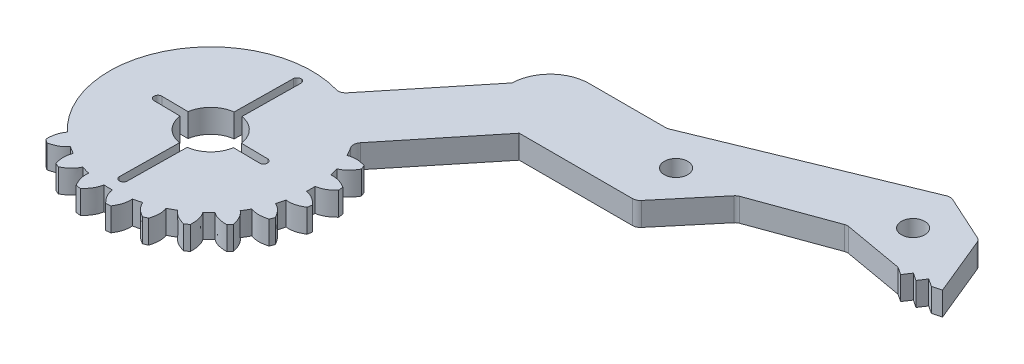
from build123d import *

# Parameters (mm, degrees)
SKETCH1_R           = 1.5
BOSS_EXTRUDE1_DEPTH = 3
BOSS_EXTRUDE2_DEPTH = 3


with BuildPart() as part:
    # Sketch1 → Boss-Extrude1 (new body)
    with BuildSketch(Plane(origin=(0, 0, 0), x_dir=(1, 0, 0), z_dir=(0, 1, 0))):
        with BuildLine():
            Line((0, -5), (15.563704926, -5))
            ThreePointArc((15.563704926, -5), (15.986456688, -4.906245523), (16.329938709, -4.642561896))
            Line((16.329938709, -4.642561896), (21.754639375, 1.826214015))
            ThreePointArc((21.754639375, 1.826214015), (21.947055414, 2.002635145), (22.178576185, 2.123243936))
            Line((22.178576185, 2.123243936), (32.010560432, 5.705074248))
            ThreePointArc((32.010560432, 5.705074248), (32.265408175, 5.761651409), (32.526215439, 5.7503413))
            Line((32.526215439, 5.7503413), (40.193902186, 4.400650355))
            Line((40.193902186, 4.400650355), (41.177822493, 3.749266574))
            Line((41.177822493, 3.749266574), (41.829206274, 4.73318688))
            Line((41.829206274, 4.73318688), (42.81312658, 4.081803099))
            Line((42.81312658, 4.081803099), (43.464510361, 5.065723406))
            Line((43.464510361, 5.065723406), (44.448430668, 4.414339625))
            Line((44.448430668, 4.414339625), (45.592594685, 4.702937447))
            Line((45.592594685, 4.702937447), (42.491745918, 12.244834503))
            ThreePointArc((42.491745918, 12.244834503), (42.287055639, 12.558350103), (41.981402108, 12.774604725))
            Line((41.981402108, 12.774604725), (36.174183924, 15.419882568))
            ThreePointArc((36.174183924, 15.419882568), (35.778323444, 15.509674561), (35.379386093, 15.434727162))
            Line((35.379386093, 15.434727162), (10.182711481, 5.075121772))
            ThreePointArc((10.182711481, 5.075121772), (9.996254378, 5.018960187), (9.802448068, 5))
            Line((9.802448068, 5), (0, 5))
            ThreePointArc((0, 5), (-5, 0), (0, -5))
        make_face()
        with Locations((14.953169387, 1.184367042)):
            Circle(SKETCH1_R, mode=Mode.SUBTRACT)
        with Locations((36.81484199, 9.711510151)):
            Circle(SKETCH1_R, mode=Mode.SUBTRACT)
    extrude(amount=BOSS_EXTRUDE1_DEPTH)

    # Sketch2 → Boss-Extrude2 (add)
    with BuildSketch(Plane(origin=(0, 3, 0), x_dir=(1, 0, 0), z_dir=(0, 1, 0))):
        with BuildLine():
            ThreePointArc((3.389805898, -2.10337971), (3.440094642, -2.035794351), (3.48451646, -1.964216138))
            ThreePointArc((3.48451646, -1.964216138), (2.030149694, 3.446518855), (-3.407273814, 2.095348456))
            ThreePointArc((-3.407273814, 2.095348456), (-3.443238029, 2.040927963), (-3.482673716, 1.988967964))
            Line((-3.482673716, 1.988967964), (-14.477723162, -11.556766533))
            ThreePointArc((-14.477723162, -11.556766533), (-14.954621591, -11.88063891), (-15.531058173, -11.887442925))
            ThreePointArc((-15.531058173, -11.887442925), (-30.143162251, -17.47025394), (-28.811611281, -33.055770821))
            ThreePointArc((-28.811611281, -33.055770821), (-28.435906156, -33.457620181), (-28.043430296, -33.843106819))
            add(Edge.make_bspline(
                [(-28.043430296, -33.843106819), (-28.555703587, -34.513757614), (-28.644931052, -35.244635595), (-28.64994617, -35.971697613)],
                knots=[0, 0, 0, 0, 0.585569533, 0.585569533, 0.585569533, 0.585569533], degree=3))
            ThreePointArc((-28.64994617, -35.971697613), (-28.408345056, -36.165936902), (-28.162781472, -36.355141887))
            add(Edge.make_bspline(
                [(-28.162781472, -36.355141887), (-27.457247623, -36.179453762), (-26.767789168, -35.921013823), (-26.236261071, -35.265518364)],
                knots=[0, 0, 0, 0, 0.585569533, 0.585569533, 0.585569533, 0.585569533], degree=3))
            ThreePointArc((-26.236261071, -35.265518364), (-25.769237301, -35.556483877), (-25.290271355, -35.827341321))
            add(Edge.make_bspline(
                [(-25.290271355, -35.827341321), (-25.611512158, -36.607726329), (-25.50853413, -37.336794014), (-25.325200865, -38.040380002)],
                knots=[0, 0, 0, 0, 0.585569533, 0.585569533, 0.585569533, 0.585569533], degree=3))
            ThreePointArc((-25.325200865, -38.040380002), (-25.041559282, -38.165469778), (-24.755393221, -38.284671227))
            add(Edge.make_bspline(
                [(-24.755393221, -38.284671227), (-24.119371288, -37.932363933), (-23.520294738, -37.504285143), (-23.176532731, -36.733555556)],
                knots=[0, 0, 0, 0, 0.585569533, 0.585569533, 0.585569533, 0.585569533], degree=3))
            ThreePointArc((-23.176532731, -36.733555556), (-22.650115136, -36.893732522), (-22.117366351, -37.031394704))
            add(Edge.make_bspline(
                [(-22.117366351, -37.031394704), (-22.225682637, -37.868331976), (-21.937516898, -38.545904607), (-21.578329109, -39.178066343)],
                knots=[0, 0, 0, 0, 0.585569533, 0.585569533, 0.585569533, 0.585569533], degree=3))
            ThreePointArc((-21.578329109, -39.178066343), (-21.271976762, -39.225481945), (-20.964709967, -39.266556476))
            add(Edge.make_bspline(
                [(-20.964709967, -39.266556476), (-20.441543794, -38.761639173), (-19.973675226, -38.193094393), (-19.841106121, -37.359654625)],
                knots=[0, 0, 0, 0, 0.585569533, 0.585569533, 0.585569533, 0.585569533], degree=3))
            ThreePointArc((-19.841106121, -37.359654625), (-19.291168925, -37.378127071), (-18.740943516, -37.37321272))
            add(Edge.make_bspline(
                [(-18.740943516, -37.37321272), (-18.628953709, -38.209666363), (-18.175238278, -38.789568486), (-17.664674019, -39.307225192)],
                knots=[0, 0, 0, 0, 0.585569533, 0.585569533, 0.585569533, 0.585569533], degree=3))
            ThreePointArc((-17.664674019, -39.307225192), (-17.356488314, -39.273735324), (-17.049060511, -39.233883777))
            add(Edge.make_bspline(
                [(-17.049060511, -39.233883777), (-16.674403007, -38.610765744), (-16.369626891, -37.940500362), (-16.457285053, -37.101147956)],
                knots=[0, 0, 0, 0, 0.585569533, 0.585569533, 0.585569533, 0.585569533], degree=3))
            ThreePointArc((-16.457285053, -37.101147956), (-15.921305484, -36.97665678), (-15.391100488, -36.829501036))
            add(Edge.make_bspline(
                [(-15.391100488, -36.829501036), (-15.066436507, -37.608468117), (-14.478091341, -38.051180359), (-13.850944723, -38.419054587)],
                knots=[0, 0, 0, 0, 0.585569533, 0.585569533, 0.585569533, 0.585569533], degree=3))
            ThreePointArc((-13.850944723, -38.419054587), (-13.561928007, -38.306941529), (-13.275289891, -38.18887972))
            add(Edge.make_bspline(
                [(-13.275289891, -38.18887972), (-13.074673346, -37.490025422), (-12.953759671, -36.763716915), (-13.255671342, -35.975652351)],
                knots=[0, 0, 0, 0, 0.585569533, 0.585569533, 0.585569533, 0.585569533], degree=3))
            ThreePointArc((-13.255671342, -35.975652351), (-12.77017552, -35.716681391), (-12.296123531, -35.437312703))
            add(Edge.make_bspline(
                [(-12.296123531, -35.437312703), (-11.780910691, -36.105707904), (-11.098030541, -36.381060158), (-10.397040569, -36.574081887)],
                knots=[0, 0, 0, 0, 0.585569533, 0.585569533, 0.585569533, 0.585569533], degree=3))
            ThreePointArc((-10.397040569, -36.574081887), (-10.146888853, -36.390985958), (-9.90057434, -36.202759604))
            add(Edge.make_bspline(
                [(-9.90057434, -36.202759604), (-9.88767044, -35.475794806), (-9.958859272, -34.742939899), (-10.45444967, -34.059868475)],
                knots=[0, 0, 0, 0, 0.585569533, 0.585569533, 0.585569533, 0.585569533], degree=3))
            ThreePointArc((-10.45444967, -34.059868475), (-10.052523335, -33.68406617), (-9.666930212, -33.291523058))
            add(Edge.make_bspline(
                [(-9.666930212, -33.291523058), (-8.996279416, -33.803796349), (-8.265401435, -33.893023814), (-7.538339418, -33.898038932)],
                knots=[0, 0, 0, 0, 0.585569533, 0.585569533, 0.585569533, 0.585569533], degree=3))
            ThreePointArc((-7.538339418, -33.898038932), (-7.344100128, -33.656437817), (-7.154895143, -33.410874234))
            add(Edge.make_bspline(
                [(-7.154895143, -33.410874234), (-7.330583268, -32.705340385), (-7.589023207, -32.01588193), (-8.244518666, -31.484353833)],
                knots=[0, 0, 0, 0, 0.585569533, 0.585569533, 0.585569533, 0.585569533], degree=3))
            ThreePointArc((-8.244518666, -31.484353833), (-7.95355245, -31.01733048), (-7.682695709, -30.538364117))
            add(Edge.make_bspline(
                [(-7.682695709, -30.538364117), (-6.902310701, -30.85960492), (-6.173243016, -30.756626892), (-5.469657028, -30.573293627)],
                knots=[0, 0, 0, 0, 0.585569533, 0.585569533, 0.585569533, 0.585569533], degree=3))
            ThreePointArc((-5.469657028, -30.573293627), (-5.344567252, -30.289652043), (-5.225365803, -30.003485982))
            add(Edge.make_bspline(
                [(-5.225365803, -30.003485982), (-5.577673097, -29.36746405), (-6.005751887, -28.768387499), (-6.776481475, -28.424625492)],
                knots=[0, 0, 0, 0, 0.585569533, 0.585569533, 0.585569533, 0.585569533], degree=3))
            ThreePointArc((-6.776481475, -28.424625492), (-6.616304485, -27.898207904), (-6.478642326, -27.365459113))
            add(Edge.make_bspline(
                [(-6.478642326, -27.365459113), (-5.641705054, -27.473775399), (-4.964132423, -27.18560966), (-4.331970687, -26.826421871)],
                knots=[0, 0, 0, 0, 0.585569533, 0.585569533, 0.585569533, 0.585569533], degree=3))
            ThreePointArc((-4.331970687, -26.826421871), (-4.284555085, -26.520069523), (-4.243480554, -26.212802729))
            add(Edge.make_bspline(
                [(-4.243480554, -26.212802729), (-4.748397857, -25.689636555), (-5.316942637, -25.221767987), (-6.150382405, -25.089198883)],
                knots=[0, 0, 0, 0, 0.585569533, 0.585569533, 0.585569533, 0.585569533], degree=3))
            ThreePointArc((-6.150382405, -25.089198883), (-6.131912975, -24.539261649), (-6.13682431, -23.989036278))
            add(Edge.make_bspline(
                [(-6.13682431, -23.989036278), (-5.300370667, -23.877046471), (-4.720468545, -23.42333104), (-4.202811838, -22.912766781)],
                knots=[0, 0, 0, 0, 0.585569533, 0.585569533, 0.585569533, 0.585569533], degree=3))
            ThreePointArc((-4.202811838, -22.912766781), (-4.236301706, -22.604581076), (-4.276153253, -22.297153273))
            add(Edge.make_bspline(
                [(-4.276153253, -22.297153273), (-4.899271286, -21.922495769), (-5.569536668, -21.617719652), (-6.408889074, -21.705377815)],
                knots=[0, 0, 0, 0, 0.585569533, 0.585569533, 0.585569533, 0.585569533], degree=3))
            ThreePointArc((-6.408889074, -21.705377815), (-6.533401359, -21.169403624), (-6.680535995, -20.639193249))
            add(Edge.make_bspline(
                [(-6.680535995, -20.639193249), (-5.901568913, -20.314529269), (-5.458856671, -19.726184103), (-5.090982443, -19.099037485)],
                knots=[0, 0, 0, 0, 0.585569533, 0.585569533, 0.585569533, 0.585569533], degree=3))
            ThreePointArc((-5.090982443, -19.099037485), (-5.203095501, -18.810020768), (-5.32115731, -18.523382653))
            add(Edge.make_bspline(
                [(-5.32115731, -18.523382653), (-6.020011609, -18.322766108), (-6.746320115, -18.201852432), (-7.534384679, -18.503764104)],
                knots=[0, 0, 0, 0, 0.585569533, 0.585569533, 0.585569533, 0.585569533], degree=3))
            ThreePointArc((-7.534384679, -18.503764104), (-7.832131183, -17.949741979), (-8.1563259, -17.410769549))
            ThreePointArc((-8.1563259, -17.410769549), (-8.310437489, -16.816722086), (-8.088540896, -16.244529224))
            Line((-8.088540896, -16.244529224), (3.389805898, -2.10337971))
        make_face()
        with BuildLine():
            ThreePointArc((-18.588322725, -20.921387696), (-16.62578898, -21.934876408), (-15.660972151, -23.921790234))
            Line((-15.660972151, -23.921790234), (-12.269810743, -23.963581954))
            ThreePointArc((-12.269810743, -23.963581954), (-11.776010098, -24.469705382), (-12.282133526, -24.963506026))
            Line((-12.282133526, -24.963506026), (-15.673294934, -24.921714305))
            ThreePointArc((-15.673294934, -24.921714305), (-16.686783646, -26.88424805), (-18.673697472, -27.849064879))
            Line((-18.673697472, -27.849064879), (-18.767245641, -35.439968932))
            ThreePointArc((-18.767245641, -35.439968932), (-19.273369068, -35.933769576), (-19.767169712, -35.427646148))
            Line((-19.767169712, -35.427646148), (-19.673621544, -27.836742096))
            ThreePointArc((-19.673621544, -27.836742096), (-21.636155288, -26.823253384), (-22.600972117, -24.836339558))
            Line((-22.600972117, -24.836339558), (-25.992133526, -24.794547838))
            ThreePointArc((-25.992133526, -24.794547838), (-26.48593417, -24.28842441), (-25.979810743, -23.794623766))
            Line((-25.979810743, -23.794623766), (-22.588649334, -23.836415487))
            ThreePointArc((-22.588649334, -23.836415487), (-21.575160622, -21.873881742), (-19.588246796, -20.909064913))
            Line((-19.588246796, -20.909064913), (-19.496047894, -13.427646148))
            ThreePointArc((-19.496047894, -13.427646148), (-18.989924466, -12.933845504), (-18.496123822, -13.439968932))
            Line((-18.496123822, -13.439968932), (-18.588322725, -20.921387696))
        make_face(mode=Mode.SUBTRACT)
    extrude(amount=-BOSS_EXTRUDE2_DEPTH)


solid = part.part
